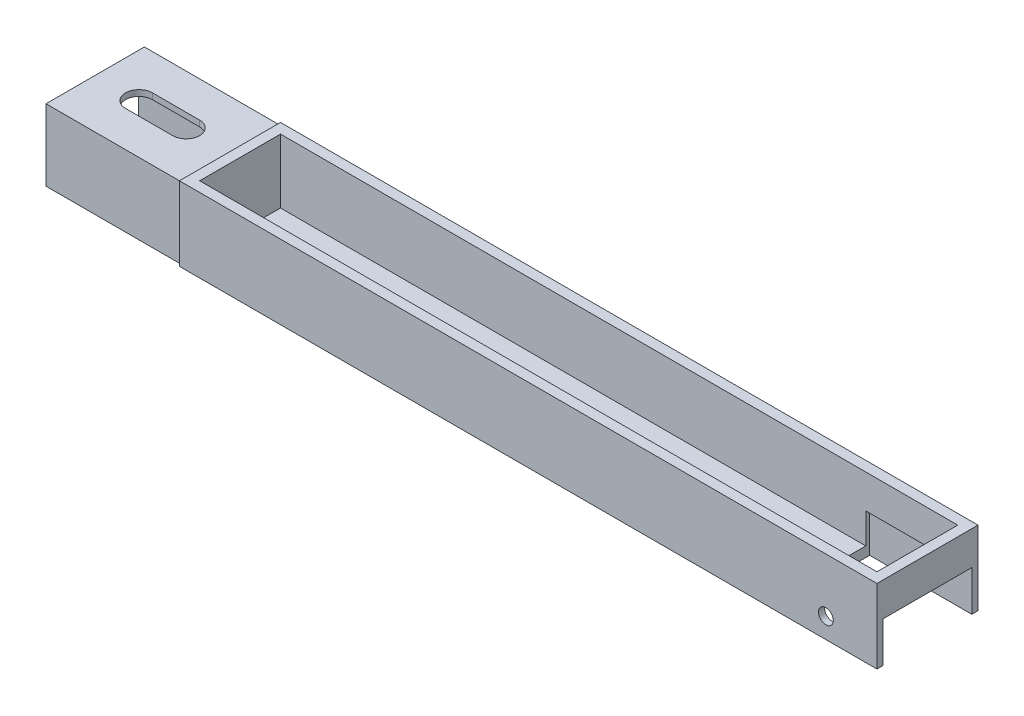
from build123d import *

# Parameters (mm, degrees)
SKETCH1_W           = 207
SKETCH1_H           = 30
BOSS_EXTRUDE1_DEPTH = 22
SHELL1_T            = -3
SKETCH2_W           = 207
SKETCH2_H           = 10
CUT_EXTRUDE1_DEPTH  = 3
SKETCH3_W           = 29.2
SKETCH3_H           = 21.2
BOSS_EXTRUDE2_DEPTH = 40
SKETCH4_W           = 25.7
SKETCH4_H           = 17.7
CUT_EXTRUDE2_DEPTH  = 40
CUT_EXTRUDE3_DEPTH  = 146.889718623
SKETCH6_W           = 30.3
SKETCH6_H           = 26.3
CUT_EXTRUDE4_DEPTH  = 12
SKETCH7_R           = 2.2
CUT_EXTRUDE5_DEPTH  = 149.243886889


with BuildPart() as part:
    # Sketch1 → Boss-Extrude1 (new body)
    with BuildSketch(Plane(origin=(0, 0, 0), x_dir=(1, 0, 0), z_dir=(0, 1, 0))):
        Rectangle(SKETCH1_W, SKETCH1_H)
    extrude(amount=BOSS_EXTRUDE1_DEPTH)

    # Shell1
    shell1_openings = [part.faces().sort_by_distance(p)[0] for p in [
        (0, 22, 0),
    ]]
    offset(amount=SHELL1_T, openings=shell1_openings, kind=Kind.INTERSECTION)

    # Sketch2 → Cut-Extrude1 (cut)
    with BuildSketch(Plane(origin=(0, 0, 0), x_dir=(-1, 0, 0), z_dir=(0, -1, 0))):
        Rectangle(SKETCH2_W, SKETCH2_H)
    extrude(amount=-CUT_EXTRUDE1_DEPTH, mode=Mode.SUBTRACT)

    # Sketch3 → Boss-Extrude2 (add)
    with BuildSketch(Plane.ZY.offset(103.5)):
        with Locations((0, 11)):
            Rectangle(SKETCH3_W, SKETCH3_H)
    extrude(amount=BOSS_EXTRUDE2_DEPTH)

    # Sketch4 → Cut-Extrude2 (cut)
    with BuildSketch(Plane.ZY.offset(143.5)):
        with Locations((0, 11)):
            Rectangle(SKETCH4_W, SKETCH4_H)
    extrude(amount=-CUT_EXTRUDE2_DEPTH, mode=Mode.SUBTRACT)

    # Sketch5 → Cut-Extrude3 (cut, through all)
    with BuildSketch(Plane(origin=(0, 21.6, 0), x_dir=(1, 0, 0), z_dir=(0, 1, 0))):
        with BuildLine():
            Line((-130.5, 4), (-116.5, 4))
            ThreePointArc((-116.5, 4), (-112.5, 0), (-116.5, -4))
            Line((-116.5, -4), (-130.5, -4))
            ThreePointArc((-130.5, -4), (-134.5, 0), (-130.5, 4))
        make_face()
    extrude(amount=-CUT_EXTRUDE3_DEPTH, mode=Mode.SUBTRACT)

    # Sketch6 → Cut-Extrude4 (cut)
    with BuildSketch(Plane(origin=(0, 0, 0), x_dir=(-1, 0, 0), z_dir=(0, -1, 0))):
        with Locations((-88.35, 0)):
            Rectangle(SKETCH6_W, SKETCH6_H)
    extrude(amount=-CUT_EXTRUDE4_DEPTH, mode=Mode.SUBTRACT)

    # Sketch7 → Cut-Extrude5 (cut, through all)
    with BuildSketch(Plane.XY.offset(15)):
        with Locations((88.35, 6)):
            Circle(SKETCH7_R)
    extrude(amount=-CUT_EXTRUDE5_DEPTH, mode=Mode.SUBTRACT)


solid = part.part
